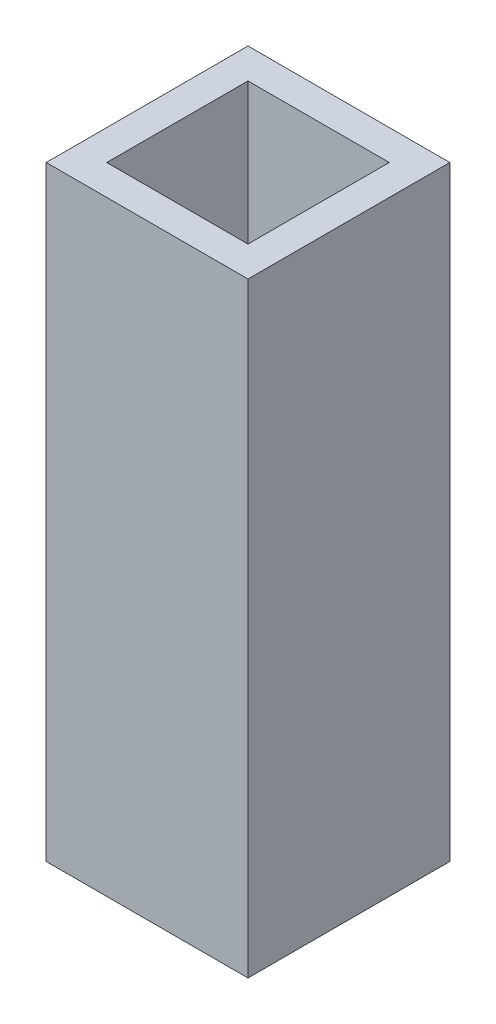
from build123d import *

# Parameters (mm, degrees)
SKETCH1_W           = 12.7
SKETCH1_H           = 12.7
SKETCH1_W_2         = 8.89
SKETCH1_H_2         = 8.89
BOSS_EXTRUDE1_DEPTH = 38.1


with BuildPart() as part:
    # Sketch1 → Boss-Extrude1 (new body)
    with BuildSketch(Plane(origin=(0, 0, 0), x_dir=(1, 0, 0), z_dir=(0, 1, 0))):
        with Locations((6.35, 6.35)):
            Rectangle(SKETCH1_W, SKETCH1_H)
        with Locations((6.35, 6.35)):
            Rectangle(SKETCH1_W_2, SKETCH1_H_2, mode=Mode.SUBTRACT)
    extrude(amount=BOSS_EXTRUDE1_DEPTH)


solid = part.part
